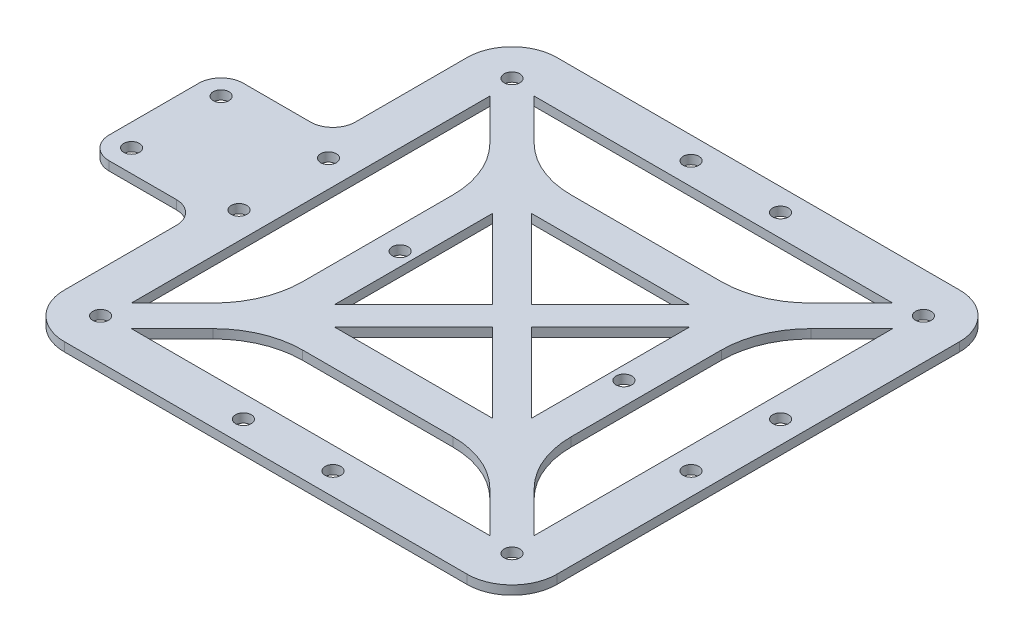
from build123d import *

# Parameters (mm, degrees)
SKETCH_1_R      = 1.75
EXTRUDE_1_DEPTH = 2


with BuildPart() as part:
    # 草图1 → 凸台-拉伸1 (new body)
    with BuildSketch(Plane(origin=(0, 0, 0), x_dir=(1, 0, 0), z_dir=(0, 1, 0))):
        with BuildLine():
            Line((-45, -55), (45, -55))
            ThreePointArc((45, -55), (52.071067812, -52.071067812), (55, -45))
            Line((55, -45), (55, 45))
            ThreePointArc((55, 45), (52.071067812, 52.071067812), (45, 55))
            Line((45, 55), (-45, 55))
            ThreePointArc((-45, 55), (-52.071067812, 52.071067812), (-55, 45))
            Line((-55, 45), (-55, 19.989791925))
            ThreePointArc((-55, 19.989791925), (-56.465368542, 16.453355802), (-60.002552182, 14.989792577))
            Line((-60.002552182, 14.989792577), (-74.997444562, 14.997446515))
            ThreePointArc((-74.997444562, 14.997446515), (-78.534628201, 13.53388329), (-79.999996743, 9.997447167))
            Line((-79.999996743, 9.997447167), (-79.999996743, -9.997447167))
            ThreePointArc((-79.999996743, -9.997447167), (-78.534628201, -13.53388329), (-74.997444562, -14.997446515))
            Line((-74.997444562, -14.997446515), (-60.002552182, -14.989792577))
            ThreePointArc((-60.002552182, -14.989792577), (-56.465368542, -16.453355802), (-55, -19.989791925))
            Line((-55, -19.989791925), (-55, -45))
            ThreePointArc((-55, -45), (-52.071067812, -52.071067812), (-45, -55))
        make_face()
        with Locations(Location((-45.961940777, -45.961940777, 0), (0, 0, 270))):
            Circle(SKETCH_1_R, mode=Mode.SUBTRACT)
        with Locations(Location((-75, -10, 0), (0, 0, 270))):
            Circle(SKETCH_1_R, mode=Mode.SUBTRACT)
        with Locations(Location((-51, -10, 0), (0, 0, 270))):
            Circle(SKETCH_1_R, mode=Mode.SUBTRACT)
        with BuildLine():
            Line((-45, 40.050252532), (-35.857864376, 30.908116908))
            ThreePointArc((-35.857864376, 30.908116908), (-31.52240935, 24.419649932), (-30, 16.765981284))
            Line((-30, 16.765981284), (-30, -16.765981284))
            ThreePointArc((-30, -16.765981284), (-31.52240935, -24.419649932), (-35.857864376, -30.908116908))
            Line((-35.857864376, -30.908116908), (-45, -40.050252532))
            Line((-45, -40.050252532), (-45, 40.050252532))
        make_face(mode=Mode.SUBTRACT)
        with Locations(Location((-10, -50, 0), (0, 0, 270))):
            Circle(SKETCH_1_R, mode=Mode.SUBTRACT)
        with Locations(Location((10, -50, 0), (0, 0, 270))):
            Circle(SKETCH_1_R, mode=Mode.SUBTRACT)
        with BuildLine():
            Line((-40.050252532, -45), (-30.908116908, -35.857864376))
            ThreePointArc((-30.908116908, -35.857864376), (-24.419649932, -31.52240935), (-16.765981284, -30))
            Line((-16.765981284, -30), (16.765981284, -30))
            ThreePointArc((16.765981284, -30), (24.419649932, -31.52240935), (30.908116908, -35.857864376))
            Line((30.908116908, -35.857864376), (40.050252532, -45))
            Line((40.050252532, -45), (-40.050252532, -45))
        make_face(mode=Mode.SUBTRACT)
        with Locations(Location((45.961940777, -45.961940777, 0), (0, 0, 270))):
            Circle(SKETCH_1_R, mode=Mode.SUBTRACT)
        Polygon((0, -4.32233047), (17.67766953, -22), (-17.67766953, -22), align=None, mode=Mode.SUBTRACT)
        with Locations(Location((50, -10, 0), (0, 0, 270))):
            Circle(SKETCH_1_R, mode=Mode.SUBTRACT)
        with Locations(Location((-75, 10, 0), (0, 0, 270))):
            Circle(SKETCH_1_R, mode=Mode.SUBTRACT)
        with Locations(Location((-51, 10, 0), (0, 0, 270))):
            Circle(SKETCH_1_R, mode=Mode.SUBTRACT)
        with Locations(Location((-25, 0, 0), (0, 0, 270))):
            Circle(SKETCH_1_R, mode=Mode.SUBTRACT)
        Polygon((-4.32233047, 0), (-22, -17.67766953), (-22, 17.67766953), align=None, mode=Mode.SUBTRACT)
        with Locations(Location((-45.961940777, 45.961940777, 0), (0, 0, 270))):
            Circle(SKETCH_1_R, mode=Mode.SUBTRACT)
        Polygon((0, 4.32233047), (-17.67766953, 22), (17.67766953, 22), align=None, mode=Mode.SUBTRACT)
        Polygon((4.32233047, 0), (22, 17.67766953), (22, -17.67766953), align=None, mode=Mode.SUBTRACT)
        with Locations(Location((25, 0, 0), (0, 0, 270))):
            Circle(SKETCH_1_R, mode=Mode.SUBTRACT)
        with BuildLine():
            Line((45, -40.050252532), (35.857864376, -30.908116908))
            ThreePointArc((35.857864376, -30.908116908), (31.52240935, -24.419649932), (30, -16.765981284))
            Line((30, -16.765981284), (30, 16.765981284))
            ThreePointArc((30, 16.765981284), (31.52240935, 24.419649932), (35.857864376, 30.908116908))
            Line((35.857864376, 30.908116908), (45, 40.050252532))
            Line((45, 40.050252532), (45, -40.050252532))
        make_face(mode=Mode.SUBTRACT)
        with Locations(Location((50, 10, 0), (0, 0, 270))):
            Circle(SKETCH_1_R, mode=Mode.SUBTRACT)
        with BuildLine():
            ThreePointArc((-16.765981284, 30), (-24.419649932, 31.52240935), (-30.908116908, 35.857864376))
            Line((-30.908116908, 35.857864376), (-40.050252532, 45))
            Line((-40.050252532, 45), (40.050252532, 45))
            Line((40.050252532, 45), (30.908116908, 35.857864376))
            ThreePointArc((30.908116908, 35.857864376), (24.419649932, 31.52240935), (16.765981284, 30))
            Line((16.765981284, 30), (-16.765981284, 30))
        make_face(mode=Mode.SUBTRACT)
        with Locations(Location((-10, 50, 0), (0, 0, 270))):
            Circle(SKETCH_1_R, mode=Mode.SUBTRACT)
        with Locations(Location((10, 50, 0), (0, 0, 270))):
            Circle(SKETCH_1_R, mode=Mode.SUBTRACT)
        with Locations(Location((45.961940777, 45.961940777, 0), (0, 0, 270))):
            Circle(SKETCH_1_R, mode=Mode.SUBTRACT)
    extrude(amount=EXTRUDE_1_DEPTH)


solid = part.part
